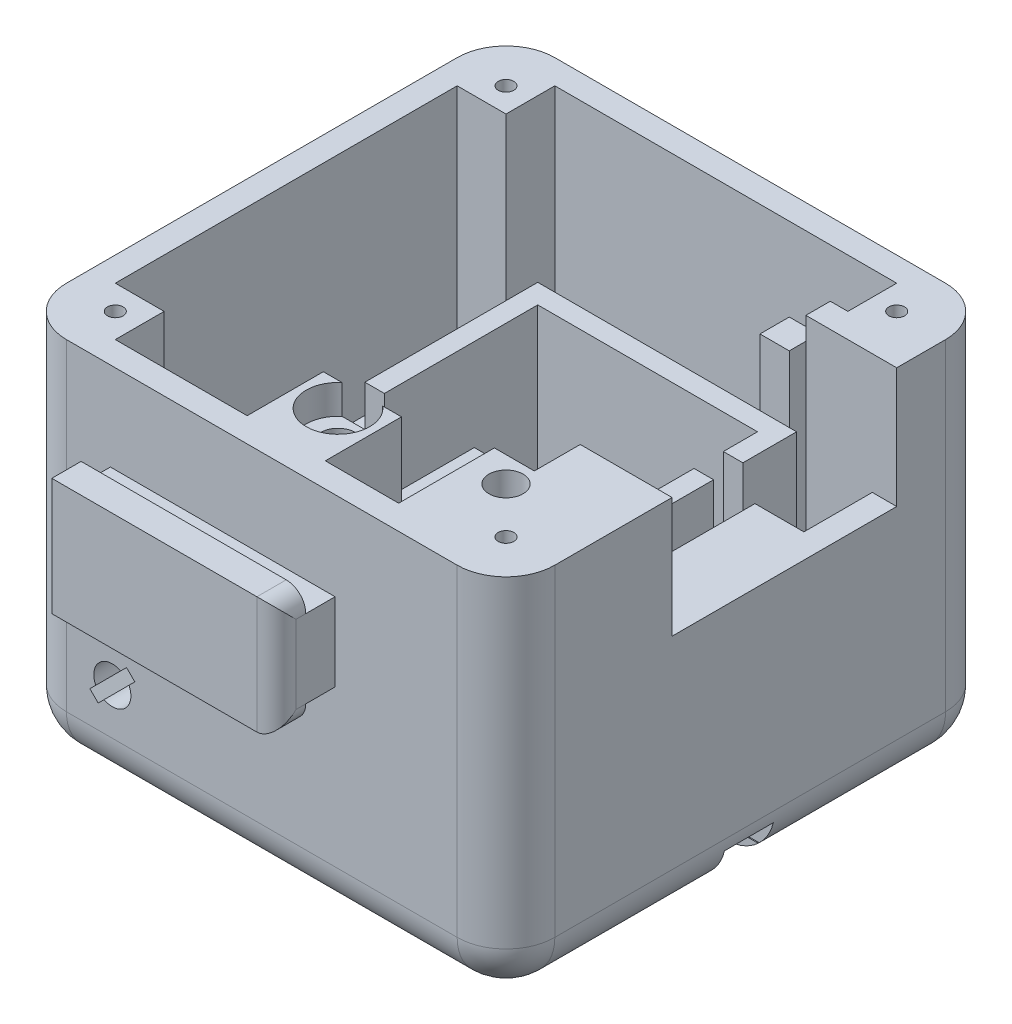
from build123d import *

# Parameters (mm, degrees)
SKETCH1_W                          = 50
SKETCH1_H                          = 50
BASE_SHELL_DEPTH                   = 38
SHELL1_T                           = -2.5
FILLET1_R                          = 5
SKETCH2_W                          = 23
SKETCH2_H                          = 12
LOCK_CONNECTOR_EXTRUDE_DEPTH       = 6
SKETCH3_W                          = 3
SKETCH3_H                          = 2
LOCK_CONNECTOR_CUT_DEPTH           = 59.832389039
LOCK_CONNECTOR_FILLET_R            = 2
SKETCH8_W                          = 45
SKETCH8_H                          = 16
BOTTOM_CONNECTOR_INSIDE_DEPTH      = 11
SKETCH10_W                         = 32.5
SKETCH10_H                         = 8.5
BOTTOM_FEMALE_BOTTOM_CUT_DEPTH     = 2.6
SKETCH7_W                          = 32.5
SKETCH7_H                          = 12.5
BOTTOM_FEMALE_TOP_CUT_DEPTH        = 3.2
ROUNDED_ENTRANCE_REACH             = 59.546
ROUNDED_ENTRANCE_DIRECTION_2_REACH = 59.546
SKETCH22_W                         = 5
SKETCH22_H                         = 2.5
HEADER_PIN_CUT_DEPTH               = 59.832389039
HEADER_PIN_HOLDER_REACH            = 57.045
SKETCH23_W                         = 17.365953144
SKETCH23_H                         = 2.5
SUPPORT_START                      = -1.35
SKETCH24_W                         = 13.365953144
SKETCH24_H                         = 4.8
SUPPORT_MATERIAL_CUT_DEPTH         = 1.35
SKETCH25_W                         = 2
SKETCH25_H                         = 3.1
WIRE_CUT_DEPTH                     = 7.3
SKETCH14_R                         = 1.25
LOCK_BOTTOM_SUPPORT_DEPTH          = 4.5
SKETCH27_W                         = 5
SKETCH27_H                         = 5
SCREW_PILLAR_DEPTH                 = 35.5
MIRROR2_COPY_1_SKETCH_W            = 5
MIRROR2_COPY_1_SKETCH_H            = 5
MIRROR2_COPY_1_DEPTH               = 35.5
SKETCH30_W                         = 6.9
SKETCH30_H                         = 4.7
BOSS_EXTRUDE2_DEPTH                = 35.5
CUT_EXTRUDE1_REACH                 = 72.036
SKETCH31_W                         = 23
SKETCH31_H                         = 12.3
SKETCH37_W                         = 5.011585452
SKETCH37_H                         = 16
SERVO1_BOTTOM_SUPPORT_DEPTH        = 12.2
SKETCH43_W                         = 6.8
SKETCH43_H                         = 2.5
BOSS_EXTRUDE7_DEPTH                = 35.5
SKETCH34_W                         = 8
SKETCH34_H                         = 8
BOSS_EXTRUDE4_DEPTH                = 7.8
SKETCH35_R                         = 3.25
SPRING_CUT_DEPTH                   = 3
SKETCH36_R                         = 1.75
TOP_SHELL_LOCK_CUT_DEPTH           = 8
BOSS_EXTRUDE3_DEPTH                = 6
SKETCH33_R                         = 1.75
CUT_EXTRUDE2_DEPTH                 = 6
BOSS_EXTRUDE6_DEPTH                = 19.9
SKETCH39_W                         = 2
SKETCH39_H                         = 3
CUT_EXTRUDE5_DEPTH                 = 10
SKETCH40_W                         = 22.5
SKETCH40_H                         = 9.2
SERVO2_BASE_DEPTH                  = 2.8
LOCK_SUPPORT_DEPTH                 = 17
LOCK_CUT_DEPTH                     = 19.5
SKETCH11_R                         = 3.75
SPRING_GAP_DEPTH                   = 20
FLANG_GAP_DEPTH                    = 19
SKETCH13_W                         = 4.5
SKETCH13_H                         = 12.5
LOCK_GAP_DEPTH                     = 5
SKETCH46_W                         = 3
SKETCH46_H                         = 3
BOSS_EXTRUDE9_DEPTH                = 30
SKETCH47_W                         = 2
SKETCH47_H                         = 3.1
CUT_EXTRUDE6_DEPTH                 = 49.030433061


with BuildPart() as part:
    # Sketch1 → base shell (new body)
    with BuildSketch(Plane(origin=(0, 0, 0), x_dir=(1, 0, 0), z_dir=(0, 1, 0))):
        Rectangle(SKETCH1_W, SKETCH1_H)
    extrude(amount=BASE_SHELL_DEPTH)

    # Shell1
    shell1_openings = [part.faces().sort_by_distance(p)[0] for p in [
        (0, 38, 0),
    ]]
    offset(amount=SHELL1_T, openings=shell1_openings, kind=Kind.INTERSECTION)

    # Fillet1
    fillet1_edges = [part.edges().sort_by_distance(p)[0] for p in [
        (0, 0, -25),
        (25, 0, 0),
        (0, 0, 25),
        (-25, 0, 0),
        (-25, 19, -25),
        (25, 19, -25),
        (25, 19, 25),
        (-25, 19, 25),
    ]]
    fillet(fillet1_edges, radius=FILLET1_R)

    # Sketch2 → lock connector extrude (add)
    with BuildSketch(Plane.XY.offset(25)):
        with Locations((-4, 24.95)):
            Rectangle(SKETCH2_W, SKETCH2_H)
    extrude(amount=LOCK_CONNECTOR_EXTRUDE_DEPTH)

    # Sketch3 → lock connector cut (cut, through all)
    with BuildSketch(Plane(origin=(7.5, 0, 0), x_dir=(0, 0, -1), z_dir=(1, 0, 0))):
        with Locations((-26.5, 19.95)):
            Rectangle(SKETCH3_W, SKETCH3_H)
        with Locations((-26.5, 29.95)):
            Rectangle(SKETCH3_W, SKETCH3_H)
    extrude(amount=-LOCK_CONNECTOR_CUT_DEPTH, mode=Mode.SUBTRACT)

    # lock connector fillet
    lock_connector_fillet_edges = [part.edges().sort_by_distance(p)[0] for p in [
        (7.5, 18.95, 29.5),
        (7.5, 30.95, 29.5),
        (7.5, 24.95, 31),
    ]]
    fillet(lock_connector_fillet_edges, radius=LOCK_CONNECTOR_FILLET_R)

    # Sketch8 → bottom connector inside (add)
    with BuildSketch(Plane(origin=(0, 2.5, 0), x_dir=(1, 0, 0), z_dir=(0, 1, 0))):
        Rectangle(SKETCH8_W, SKETCH8_H)
    extrude(amount=BOTTOM_CONNECTOR_INSIDE_DEPTH)

    # Sketch10 → bottom female bottom cut (cut)
    with BuildSketch(Plane.XZ):
        with Locations((-8.75, 0)):
            Rectangle(SKETCH10_W, SKETCH10_H)
    extrude(amount=-BOTTOM_FEMALE_BOTTOM_CUT_DEPTH, mode=Mode.SUBTRACT)

    # Sketch7 → bottom female top cut (cut)
    with BuildSketch(Plane(origin=(0, 2.6, 0), x_dir=(-1, 0, 0), z_dir=(0, -1, 0))):
        with Locations((8.75, 0)):
            Rectangle(SKETCH7_W, SKETCH7_H)
    extrude(amount=-BOTTOM_FEMALE_TOP_CUT_DEPTH, mode=Mode.SUBTRACT)

    # rounded entrance: up to this face of the body (flat: up to its plane)
    rounded_entrance_end = Plane(part.part.faces().sort_by_distance((-8.675775938, 4.204654531, -6.25))[0])
    # Sketch26 → rounded entrance (cut, up to the picked face)
    with BuildSketch(Plane.XY.offset(-4.25), mode=Mode.PRIVATE) as rounded_entrance_sk1:
        with BuildLine():
            Line((-16, 2.6), (-24.38634244, 2.6))
            ThreePointArc((-24.38634244, 2.6), (-22.549509757, 0.698837366), (-20, 0))
            Line((-20, 0), (-18.5, 0))
            ThreePointArc((-18.5, 0), (-17.773607635, 1.80346888), (-16, 2.6))
        make_face()
    rounded_entrance_tool1 = split(extrude(rounded_entrance_sk1.sketch, amount=-ROUNDED_ENTRANCE_REACH, mode=Mode.PRIVATE), bisect_by=rounded_entrance_end, keep=Keep.BOTH, mode=Mode.PRIVATE)
    add(rounded_entrance_tool1.solids().sort_by(Axis((-20.596969, 1.517539, -4.25), (0, 0, -1)))[0], mode=Mode.SUBTRACT)

    # rounded entrance direction 2: up to this face of the body (flat: up to its plane)
    rounded_entrance_direction_2_end = Plane(part.part.faces().sort_by_distance((-8.675775938, 4.204654531, 6.25))[0])
    # Sketch26 → rounded entrance direction 2 (cut, up to the picked face)
    with BuildSketch(Plane.XY.offset(-4.25), mode=Mode.PRIVATE) as rounded_entrance_direction_2_sk1:
        with BuildLine():
            Line((-16, 2.6), (-24.38634244, 2.6))
            ThreePointArc((-24.38634244, 2.6), (-22.549509757, 0.698837366), (-20, 0))
            Line((-20, 0), (-18.5, 0))
            ThreePointArc((-18.5, 0), (-17.773607635, 1.80346888), (-16, 2.6))
        make_face()
    rounded_entrance_direction_2_tool1 = split(extrude(rounded_entrance_direction_2_sk1.sketch, amount=ROUNDED_ENTRANCE_DIRECTION_2_REACH, mode=Mode.PRIVATE), bisect_by=rounded_entrance_direction_2_end, keep=Keep.BOTH, mode=Mode.PRIVATE)
    add(rounded_entrance_direction_2_tool1.solids().sort_by(Axis((-20.596969, 1.517539, -4.25), (0, 0, 1)))[0], mode=Mode.SUBTRACT)

    # Sketch22 → header pin cut (cut, through all)
    with BuildSketch(Plane.ZY.offset(-7.5)):
        with Locations((0, 2.6)):
            Rectangle(SKETCH22_W, SKETCH22_H)
    extrude(amount=-HEADER_PIN_CUT_DEPTH, mode=Mode.SUBTRACT)

    # Sketch23 → header pin holder (cut, up to next)
    with BuildSketch(Plane.XZ, mode=Mode.PRIVATE) as header_pin_holder_sk1:
        with Locations((16.182976572, 0)):
            Rectangle(SKETCH23_W, SKETCH23_H)
    header_pin_holder_tool1 = extrude(header_pin_holder_sk1.sketch, amount=-HEADER_PIN_HOLDER_REACH, mode=Mode.PRIVATE) & part.part
    add(header_pin_holder_tool1.solids().sort_by_distance((16.182977, 0, 0))[0], mode=Mode.SUBTRACT)

    # Sketch24 → support material cut (cut)
    with BuildSketch(Plane.XZ.offset(SUPPORT_START)):
        with Locations((18.182976572, 0)):
            Rectangle(SKETCH24_W, SKETCH24_H)
    extrude(amount=SUPPORT_MATERIAL_CUT_DEPTH, mode=Mode.SUBTRACT)

    # Sketch25 → wire cut (cut)
    with BuildSketch(Plane(origin=(0, 3.85, 0), x_dir=(-1, 0, 0), z_dir=(0, -1, 0))):
        with Locations((-14.865953144, 0)):
            Rectangle(SKETCH25_W, SKETCH25_H)
    extrude(amount=-WIRE_CUT_DEPTH, mode=Mode.SUBTRACT)

    # Sketch14 → Lock bottom support (add)
    with BuildSketch(Plane.XY.offset(-6.25)):
        with Locations((-15.3, 9.7)):
            Circle(SKETCH14_R)
    extrude(amount=LOCK_BOTTOM_SUPPORT_DEPTH)

    # Sketch27 → screw pillar (add)
    with BuildSketch(Plane(origin=(0, 2.5, 0), x_dir=(1, 0, 0), z_dir=(0, 1, 0))):
        with Locations((20, 20)):
            Rectangle(SKETCH27_W, SKETCH27_H)
    screw_pillar = extrude(amount=SCREW_PILLAR_DEPTH)

    # Sketch29 → M2 Tapped Hole1 (revolve, cut)
    with BuildSketch(Plane(origin=(20, 38, -20), x_dir=(0, 0, 1), z_dir=(1, 0, 0))):
        Polygon((0, 0), (0, 5.480688495), (0.8, 5), (0.8, 0), align=None)
    m2_tapped_hole1 = revolve(axis=Axis((20, 44.35, -20), (0, -1, 0)), mode=Mode.SUBTRACT)

    # Mirror1: screw pillar, M2 Tapped Hole1 across plane
    add(screw_pillar.mirror(Plane(origin=(0, 0, 0), x_dir=(0, 0, 1), z_dir=(1, 0, 0))))
    add(m2_tapped_hole1.mirror(Plane(origin=(0, 0, 0), x_dir=(0, 0, 1), z_dir=(1, 0, 0))), mode=Mode.SUBTRACT)

    # Mirror2: screw pillar, M2 Tapped Hole1 across plane
    add(screw_pillar.mirror(Plane.XY))
    add(m2_tapped_hole1.mirror(Plane.XY), mode=Mode.SUBTRACT)

    # Mirror2 copy 1 sketch → Mirror2 copy 1 (add)
    with BuildSketch(Plane(origin=(0, 2.5, 0), x_dir=(-1, 0, 0), z_dir=(0, 1, 0))):
        with Locations((20, 20)):
            Rectangle(MIRROR2_COPY_1_SKETCH_W, MIRROR2_COPY_1_SKETCH_H)
    extrude(amount=MIRROR2_COPY_1_DEPTH)

    # Mirror2 copy 2 sketch → Mirror2 copy 2 (revolve, cut)
    with BuildSketch(Plane(origin=(-20, 38, 20), x_dir=(0, 0, -1), z_dir=(-1, 0, 0))):
        Polygon((0, 0), (0, 5.480688495), (0.8, 5), (0.8, 0), align=None)
    revolve(axis=Axis((-20, 44.35, 20), (0, -1, 0)), mode=Mode.SUBTRACT)

    # Sketch30 → Boss-Extrude2 (add)
    with BuildSketch(Plane(origin=(0, 2.5, 0), x_dir=(1, 0, 0), z_dir=(0, 1, 0))):
        with Locations((19.05, -10.35)):
            Rectangle(SKETCH30_W, SKETCH30_H)
    extrude(amount=BOSS_EXTRUDE2_DEPTH)

    # Sketch31 → Cut-Extrude1 (cut, up to next)
    with BuildSketch(Plane(origin=(25, 0, 0), x_dir=(0, 0, -1), z_dir=(1, 0, 0)), mode=Mode.PRIVATE) as cut_extrude1_sk1:
        with Locations((3.5, 31.85)):
            Rectangle(SKETCH31_W, SKETCH31_H)
    cut_extrude1_tool1 = extrude(cut_extrude1_sk1.sketch, amount=-CUT_EXTRUDE1_REACH, mode=Mode.PRIVATE) & part.part
    add(cut_extrude1_tool1.solids().sort_by_distance((25, 31.85, -3.5))[0], mode=Mode.SUBTRACT)

    # Sketch37 → servo1 bottom support (add)
    with BuildSketch(Plane(origin=(0, 13.5, 0), x_dir=(1, 0, 0), z_dir=(0, 1, 0))):
        with Locations((19.994207274, 0)):
            Rectangle(SKETCH37_W, SKETCH37_H)
    extrude(amount=SERVO1_BOTTOM_SUPPORT_DEPTH)

    # Sketch43 → Boss-Extrude7 (add)
    with BuildSketch(Plane(origin=(0, 2.5, 0), x_dir=(1, 0, 0), z_dir=(0, 1, 0))):
        with Locations((19.1, 16.25)):
            Rectangle(SKETCH43_W, SKETCH43_H)
    extrude(amount=BOSS_EXTRUDE7_DEPTH)

    # Sketch34 → Boss-Extrude4 (add)
    with BuildSketch(Plane(origin=(0, 0, 22.5), x_dir=(-1, 0, 0), z_dir=(0, 0, -1))):
        with Locations((0, 34)):
            Rectangle(SKETCH34_W, SKETCH34_H)
    extrude(amount=BOSS_EXTRUDE4_DEPTH)

    # Sketch35 → spring cut (cut)
    with BuildSketch(Plane(origin=(0, 38, 0), x_dir=(1, 0, 0), z_dir=(0, 1, 0))):
        with Locations((0, -17.2)):
            Circle(SKETCH35_R)
    extrude(amount=-SPRING_CUT_DEPTH, mode=Mode.SUBTRACT)

    # Sketch36 → top shell lock cut (cut)
    with BuildSketch(Plane(origin=(0, 35, 0), x_dir=(1, 0, 0), z_dir=(0, 1, 0))):
        with Locations(Location((0, -17.2, 0), (0, 0, 270))):
            Circle(SKETCH36_R)
    extrude(amount=-TOP_SHELL_LOCK_CUT_DEPTH, mode=Mode.SUBTRACT)

    # Sketch32 → Boss-Extrude3 (add)
    with BuildSketch(Plane(origin=(0, 38, 0), x_dir=(1, 0, 0), z_dir=(0, 1, 0))):
        Polygon((22.5, -12.7), (22.5, -17.5), (17.5, -17.5), (17.5, -22.5), (11.512280993, -22.5), (11.512280993, -17.5), (11.512280993, -12.7), align=None)
    extrude(amount=-BOSS_EXTRUDE3_DEPTH)

    # Sketch33 → Cut-Extrude2 (cut)
    with BuildSketch(Plane(origin=(0, 38, 0), x_dir=(1, 0, 0), z_dir=(0, 1, 0))):
        with Locations(Location((15.3, -15.3, 0), (0, 0, 270))):
            Circle(SKETCH33_R)
    extrude(amount=-CUT_EXTRUDE2_DEPTH, mode=Mode.SUBTRACT)

    # Sketch38 → Boss-Extrude6 (add)
    with BuildSketch(Plane(origin=(0, 5.8, 0), x_dir=(1, 0, 0), z_dir=(0, 1, 0))):
        Polygon((13.25, 16.5), (-13.25, 16.5), (-13.25, -1.2), (-11.25, -1.2), (-11.25, 14.5), (11.25, 14.5), (11.25, -1.2), (13.25, -1.2), align=None)
    extrude(amount=BOSS_EXTRUDE6_DEPTH)

    # Sketch39 → Cut-Extrude5 (cut)
    with BuildSketch(Plane(origin=(0, 25.7, 0), x_dir=(1, 0, 0), z_dir=(0, 1, 0))):
        with Locations((12.25, 9.5)):
            Rectangle(SKETCH39_W, SKETCH39_H)
    extrude(amount=-CUT_EXTRUDE5_DEPTH, mode=Mode.SUBTRACT)

    # Sketch40 → servo2 base (add)
    with BuildSketch(Plane(origin=(0, 13.5, 0), x_dir=(1, 0, 0), z_dir=(0, 1, 0))):
        with Locations((0, 3.4)):
            Rectangle(SKETCH40_W, SKETCH40_H)
    extrude(amount=SERVO2_BASE_DEPTH)

    # Sketch41 → lock support (add)
    with BuildSketch(Plane(origin=(0, 2.5, 0), x_dir=(1, 0, 0), z_dir=(0, 1, 0))):
        Polygon((-22.5, -22.5), (-8.5, -22.5), (-8.5, -8), (-22.5, -8), (-22.5, -17), align=None)
    extrude(amount=LOCK_SUPPORT_DEPTH)

    # Sketch6 → lock cut (cut)
    with BuildSketch(Plane.XY.offset(25)):
        with BuildLine():
            ThreePointArc((-16.15049081, 8.000981053), (-16.643502884, 8.356497116), (-16.999018947, 8.84950919))
            Line((-16.999018947, 8.84950919), (-17.600059711, 8.248468426))
            Line((-17.600059711, 8.248468426), (-16.751531574, 7.399940289))
            Line((-16.751531574, 7.399940289), (-16.15049081, 8.000981053))
        make_face()
        with BuildLine():
            ThreePointArc((-14.44950919, 11.399018947), (-13.956497116, 11.043502884), (-13.600981053, 10.55049081))
            Line((-13.600981053, 10.55049081), (-12.999940289, 11.151531574))
            Line((-12.999940289, 11.151531574), (-13.848468426, 12.000059711))
            Line((-13.848468426, 12.000059711), (-14.44950919, 11.399018947))
        make_face()
        with BuildLine():
            ThreePointArc((-13.4, 9.7), (-13.4509278, 10.136957664), (-13.600981053, 10.55049081))
            ThreePointArc((-13.600981053, 10.55049081), (-13.956497116, 11.043502884), (-14.44950919, 11.399018947))
            ThreePointArc((-14.44950919, 11.399018947), (-16.643502884, 11.043502884), (-16.999018947, 8.84950919))
            ThreePointArc((-16.999018947, 8.84950919), (-16.643502884, 8.356497116), (-16.15049081, 8.000981053))
            ThreePointArc((-16.15049081, 8.000981053), (-14.301484236, 8.083532781), (-13.4, 9.7))
        make_face()
    extrude(amount=-LOCK_CUT_DEPTH, mode=Mode.SUBTRACT)

    # Sketch11 → Spring gap (cut)
    with BuildSketch(Plane.XY.offset(-1.75)):
        with Locations((-15.3, 9.7)):
            Circle(SKETCH11_R)
    extrude(amount=SPRING_GAP_DEPTH, mode=Mode.SUBTRACT)

    # Sketch12 → Flang gap (cut)
    with BuildSketch(Plane.XY.offset(-1.75)):
        with BuildLine():
            Line((-15.3, 9.7), (-14.171286845, 3.298749605))
            ThreePointArc((-14.171286845, 3.298749605), (-20.27928888, 5.521880537), (-21.408002035, 11.923130932))
            Line((-21.408002035, 11.923130932), (-15.3, 9.7))
        make_face()
    extrude(amount=FLANG_GAP_DEPTH, mode=Mode.SUBTRACT)

    # Sketch13 → Lock gap (cut)
    with BuildSketch(Plane.XZ.offset(-5.8)):
        with Locations((-22.75, 0)):
            Rectangle(SKETCH13_W, SKETCH13_H)
    extrude(amount=-LOCK_GAP_DEPTH, mode=Mode.SUBTRACT)

    # Sketch46 → Boss-Extrude9 (add)
    with BuildSketch(Plane(origin=(0, 2.5, 0), x_dir=(1, 0, 0), z_dir=(0, 1, 0))):
        with Locations((11, 18)):
            Rectangle(SKETCH46_W, SKETCH46_H)
    extrude(amount=BOSS_EXTRUDE9_DEPTH)

    # Sketch47 → Cut-Extrude6 (cut, through all)
    with BuildSketch(Plane.XZ.offset(-11.15)):
        with Locations((14.865953144, 0)):
            Rectangle(SKETCH47_W, SKETCH47_H)
    extrude(amount=-CUT_EXTRUDE6_DEPTH, mode=Mode.SUBTRACT)


solid = part.part
